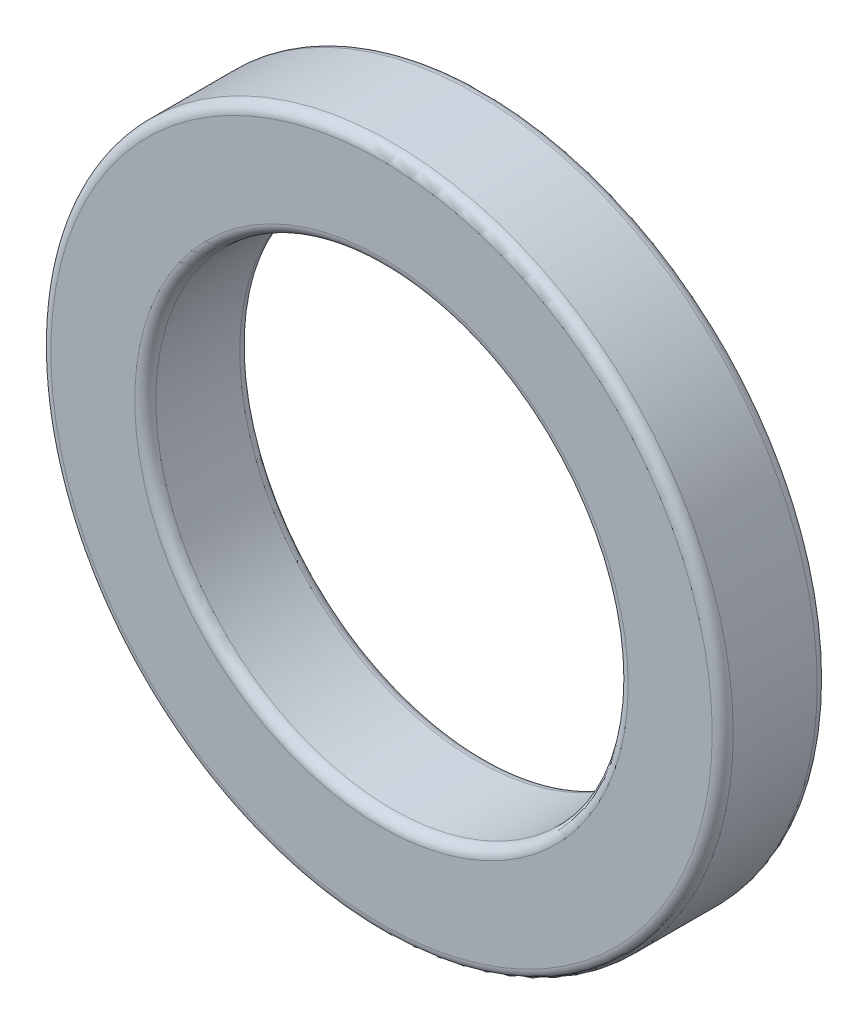
from build123d import *

# Parameters (mm, degrees)
SKETCH1_R           = 6.5
SKETCH1_R_2         = 4.5
BOSS_EXTRUDE1_DEPTH = 2
FILLET1_R           = 0.2


with BuildPart() as part:
    # Sketch1 → Boss-Extrude1 (new body)
    with BuildSketch(Plane.XY):
        Circle(SKETCH1_R)
        Circle(SKETCH1_R_2, mode=Mode.SUBTRACT)
    extrude(amount=BOSS_EXTRUDE1_DEPTH)

    # Fillet1
    fillet1_edges = [part.edges().sort_by_distance(p)[0] for p in [
        (-6.5, 0, 0),
        (-6.5, 0, 2),
        (-4.5, 0, 0),
        (-4.5, 0, 2),
    ]]
    fillet(fillet1_edges, radius=FILLET1_R)


solid = part.part
